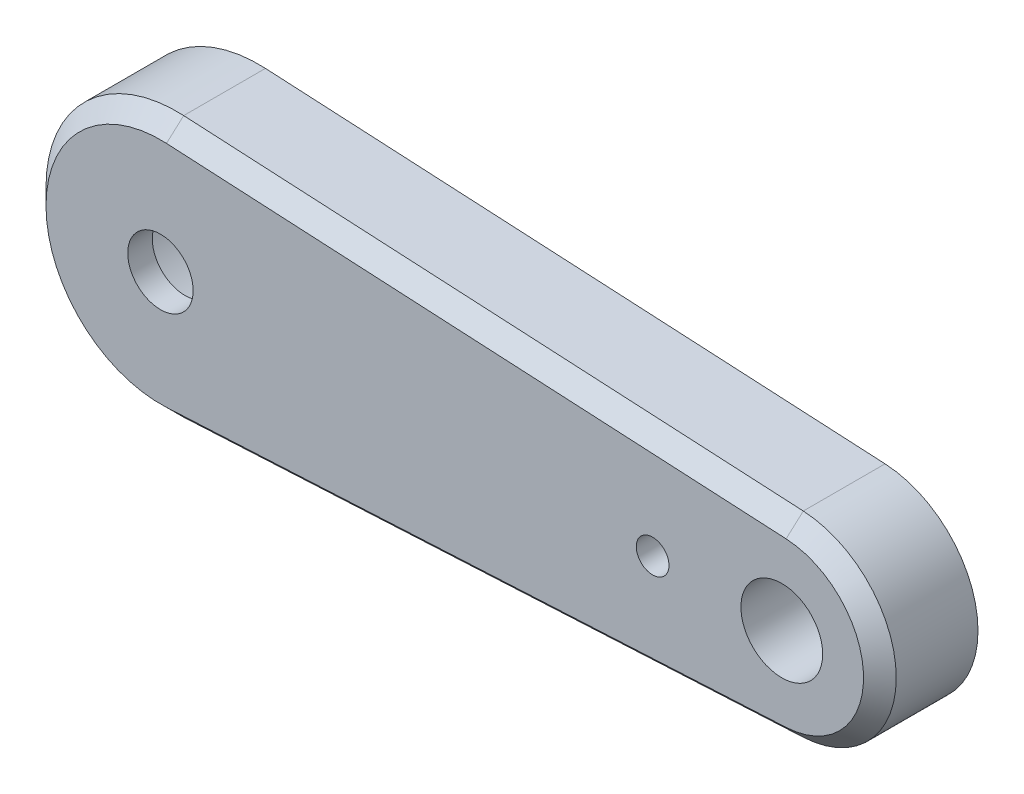
from build123d import *

# Parameters (mm, degrees)
CROQUIS1_R              = 1
CROQUIS1_R_2            = 1.25
SALIENTE_EXTRUIR1_DEPTH = 3
CORTAR_EXTRUIR1_DEPTH   = 1.5
CROQUIS3_R              = 2.1
CORTAR_EXTRUIR2_DEPTH   = 0.75
CROQUIS4_R              = 0.5
CORTAR_EXTRUIR3_DEPTH   = 23.410934831
CHAFL_N1_SIZE           = 0.5


with BuildPart() as part:
    # Croquis1 → Saliente-Extruir1 (new body)
    with BuildSketch(Plane.XY):
        with BuildLine():
            Line((0.210526316, 3.994455992), (19.157894737, 2.995841994))
            ThreePointArc((19.157894737, 2.995841994), (22, 0), (19.157894737, -2.995841994))
            Line((19.157894737, -2.995841994), (0.210526316, -3.994455992))
            ThreePointArc((0.210526316, -3.994455992), (-4, 0), (0.210526316, 3.994455992))
        make_face()
        Circle(CROQUIS1_R, mode=Mode.SUBTRACT)
        with Locations((19, 0)):
            Circle(CROQUIS1_R_2, mode=Mode.SUBTRACT)
    extrude(amount=SALIENTE_EXTRUIR1_DEPTH)

    # Croquis2 → Cortar-Extruir1 (cut)
    with BuildSketch(Plane(origin=(0, 0, 0), x_dir=(-1, 0, 0), z_dir=(0, 0, -1))):
        with BuildLine():
            Line((-15.154651163, 2.247564934), (-0.137209302, 2.946807358))
            ThreePointArc((-0.137209302, 2.946807358), (2.95, 0), (-0.137209302, -2.946807358))
            Line((-0.137209302, -2.946807358), (-15.154651163, -2.247564934))
            ThreePointArc((-15.154651163, -2.247564934), (-17.3, 0), (-15.154651163, 2.247564934))
        make_face()
    extrude(amount=-CORTAR_EXTRUIR1_DEPTH, mode=Mode.SUBTRACT)

    # Croquis3 → Cortar-Extruir2 (cut)
    with BuildSketch(Plane(origin=(0, 0, 1.5), x_dir=(-1, 0, 0), z_dir=(0, 0, -1))):
        Circle(CROQUIS3_R)
    extrude(amount=-CORTAR_EXTRUIR2_DEPTH, mode=Mode.SUBTRACT)

    # Croquis4 → Cortar-Extruir3 (cut, through all)
    with BuildSketch(Plane(origin=(0, 0, 1.5), x_dir=(-1, 0, 0), z_dir=(0, 0, -1))):
        with Locations((-15.05, 0)):
            Circle(CROQUIS4_R)
    extrude(amount=-CORTAR_EXTRUIR3_DEPTH, mode=Mode.SUBTRACT)

    # Chaflán1
    chafl_n1_edges = [part.edges().sort_by_distance(p)[0] for p in [
        (22, 0, 3),
        (9.684210526, 3.495148993, 3),
        (-4, 0, 3),
        (9.684210526, -3.495148993, 3),
    ]]
    chamfer(chafl_n1_edges, length=CHAFL_N1_SIZE)


solid = part.part
